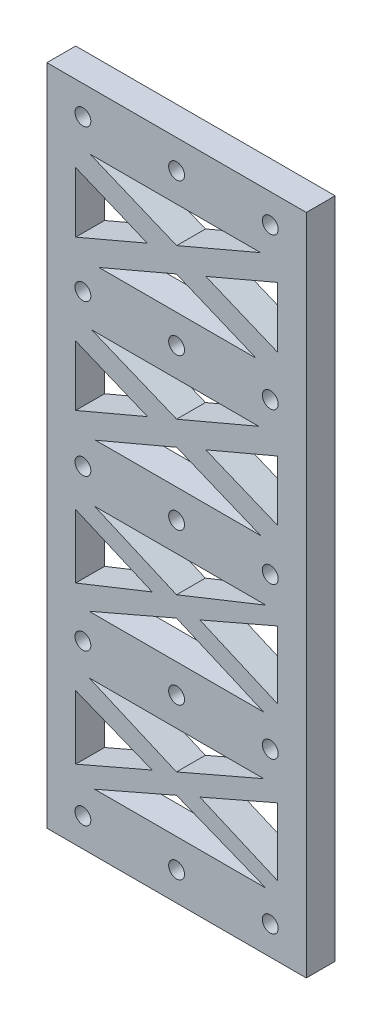
from build123d import *

# Parameters (mm, degrees)
SKETCH_1_W          = 72
SKETCH_1_H          = 100
EXTRUDE_1_DEPTH     = 8
CUT_EXTRUDE_1_REACH = 64.129
SKETCH_2_R          = 2.2
SKETCH_2_W          = 56
SKETCH_2_H          = 26
EXTRUDE_2_DEPTH     = 8
SKETCH_4_W          = 72
SKETCH_4_H          = 84
EXTRUDE_3_DEPTH     = 8
SKETCH_5_R          = 2.2
SKETCH_5_W          = 56
SKETCH_5_H          = 26
CUT_EXTRUDE_2_DEPTH = 8
EXTRUDE_4_DEPTH     = 8


with BuildPart() as part:
    # 草图1 → 凸台-拉伸1 (new body)
    with BuildSketch(Plane.XY):
        Rectangle(SKETCH_1_W, SKETCH_1_H)
    extrude(amount=EXTRUDE_1_DEPTH)

    # 草图2 → 切除-拉伸1 (cut, up to next)
    with BuildSketch(Plane.XY.offset(8), mode=Mode.PRIVATE) as cut_extrude_1_sk1:
        with Locations((-26, -42)):
            Circle(SKETCH_2_R)
    cut_extrude_1_tool1 = extrude(cut_extrude_1_sk1.sketch, amount=-CUT_EXTRUDE_1_REACH, mode=Mode.PRIVATE) & part.part
    # 草图2 → 切除-拉伸1 (cut, up to next)
    with BuildSketch(Plane.XY.offset(8), mode=Mode.PRIVATE) as cut_extrude_1_sk2:
        with Locations((0, -42)):
            Circle(SKETCH_2_R)
    cut_extrude_1_tool2 = extrude(cut_extrude_1_sk2.sketch, amount=-CUT_EXTRUDE_1_REACH, mode=Mode.PRIVATE) & part.part
    # 草图2 → 切除-拉伸1 (cut, up to next)
    with BuildSketch(Plane.XY.offset(8), mode=Mode.PRIVATE) as cut_extrude_1_sk3:
        with Locations((26, -42)):
            Circle(SKETCH_2_R)
    cut_extrude_1_tool3 = extrude(cut_extrude_1_sk3.sketch, amount=-CUT_EXTRUDE_1_REACH, mode=Mode.PRIVATE) & part.part
    # 草图2 → 切除-拉伸1 (cut, up to next)
    with BuildSketch(Plane.XY.offset(8), mode=Mode.PRIVATE) as cut_extrude_1_sk4:
        with Locations((26, 42)):
            Circle(SKETCH_2_R)
    cut_extrude_1_tool4 = extrude(cut_extrude_1_sk4.sketch, amount=-CUT_EXTRUDE_1_REACH, mode=Mode.PRIVATE) & part.part
    # 草图2 → 切除-拉伸1 (cut, up to next)
    with BuildSketch(Plane.XY.offset(8), mode=Mode.PRIVATE) as cut_extrude_1_sk5:
        with Locations((0, 42)):
            Circle(SKETCH_2_R)
    cut_extrude_1_tool5 = extrude(cut_extrude_1_sk5.sketch, amount=-CUT_EXTRUDE_1_REACH, mode=Mode.PRIVATE) & part.part
    # 草图2 → 切除-拉伸1 (cut, up to next)
    with BuildSketch(Plane.XY.offset(8), mode=Mode.PRIVATE) as cut_extrude_1_sk6:
        with Locations((-26, 42)):
            Circle(SKETCH_2_R)
    cut_extrude_1_tool6 = extrude(cut_extrude_1_sk6.sketch, amount=-CUT_EXTRUDE_1_REACH, mode=Mode.PRIVATE) & part.part
    # 草图2 → 切除-拉伸1 (cut, up to next)
    with BuildSketch(Plane.XY.offset(8), mode=Mode.PRIVATE) as cut_extrude_1_sk7:
        with Locations((-26, 0)):
            Circle(SKETCH_2_R)
    cut_extrude_1_tool7 = extrude(cut_extrude_1_sk7.sketch, amount=-CUT_EXTRUDE_1_REACH, mode=Mode.PRIVATE) & part.part
    # 草图2 → 切除-拉伸1 (cut, up to next)
    with BuildSketch(Plane.XY.offset(8), mode=Mode.PRIVATE) as cut_extrude_1_sk8:
        Circle(SKETCH_2_R)
    cut_extrude_1_tool8 = extrude(cut_extrude_1_sk8.sketch, amount=-CUT_EXTRUDE_1_REACH, mode=Mode.PRIVATE) & part.part
    # 草图2 → 切除-拉伸1 (cut, up to next)
    with BuildSketch(Plane.XY.offset(8), mode=Mode.PRIVATE) as cut_extrude_1_sk9:
        with Locations((26, 0)):
            Circle(SKETCH_2_R)
    cut_extrude_1_tool9 = extrude(cut_extrude_1_sk9.sketch, amount=-CUT_EXTRUDE_1_REACH, mode=Mode.PRIVATE) & part.part
    # 草图2 → 切除-拉伸1 (cut, up to next)
    with BuildSketch(Plane.XY.offset(8), mode=Mode.PRIVATE) as cut_extrude_1_sk10:
        with Locations((0, 21)):
            Rectangle(SKETCH_2_W, SKETCH_2_H)
    cut_extrude_1_tool10 = extrude(cut_extrude_1_sk10.sketch, amount=-CUT_EXTRUDE_1_REACH, mode=Mode.PRIVATE) & part.part
    # 草图2 → 切除-拉伸1 (cut, up to next)
    with BuildSketch(Plane.XY.offset(8), mode=Mode.PRIVATE) as cut_extrude_1_sk11:
        with Locations((0, -21)):
            Rectangle(SKETCH_2_W, SKETCH_2_H)
    cut_extrude_1_tool11 = extrude(cut_extrude_1_sk11.sketch, amount=-CUT_EXTRUDE_1_REACH, mode=Mode.PRIVATE) & part.part
    add(cut_extrude_1_tool1.solids().sort_by_distance((-26, -42, 8))[0], mode=Mode.SUBTRACT)
    add(cut_extrude_1_tool2.solids().sort_by_distance((0, -42, 8))[0], mode=Mode.SUBTRACT)
    add(cut_extrude_1_tool3.solids().sort_by_distance((26, -42, 8))[0], mode=Mode.SUBTRACT)
    add(cut_extrude_1_tool4.solids().sort_by_distance((26, 42, 8))[0], mode=Mode.SUBTRACT)
    add(cut_extrude_1_tool5.solids().sort_by_distance((0, 42, 8))[0], mode=Mode.SUBTRACT)
    add(cut_extrude_1_tool6.solids().sort_by_distance((-26, 42, 8))[0], mode=Mode.SUBTRACT)
    add(cut_extrude_1_tool7.solids().sort_by_distance((-26, 0, 8))[0], mode=Mode.SUBTRACT)
    add(cut_extrude_1_tool8.solids().sort_by_distance((0, 0, 8))[0], mode=Mode.SUBTRACT)
    add(cut_extrude_1_tool9.solids().sort_by_distance((26, 0, 8))[0], mode=Mode.SUBTRACT)
    add(cut_extrude_1_tool10.solids().sort_by_distance((0, 21, 8))[0], mode=Mode.SUBTRACT)
    add(cut_extrude_1_tool11.solids().sort_by_distance((0, -21, 8))[0], mode=Mode.SUBTRACT)

    # 草图3 → 凸台-拉伸2 (add)
    with BuildSketch(Plane.XY.offset(8)):
        Polygon((-28, 30.60122868), (-6.768682564, 21.407188314), (-28, 12.93157869), (-28, 8), (-24.288219299, 8), (-0.025829724, 18.487253581), (24.191837476, 8), (28, 8), (28, 11.903155093), (6.450556004, 21.286627452), (28, 30.60122868), (28, 34), (24.776184912, 34), (-0.016552798, 24.102660047), (-22.746110137, 34), (-28, 34), align=None)
        Polygon((-28, -8), (-24.288219299, -8), (-0.025829724, -18.487253581), (24.191837476, -8), (28, -8), (28, -11.903155093), (6.450556004, -21.286627452), (28, -30.60122868), (28, -34), (24.776184912, -34), (-0.016552798, -24.102660047), (-22.746110137, -34), (-28, -34), (-28, -30.60122868), (-6.768682564, -21.407188314), (-28, -12.93157869), align=None)
    extrude(amount=-EXTRUDE_2_DEPTH)

    # 草图4 → 凸台-拉伸3 (add)
    with BuildSketch(Plane.XY.offset(8)):
        with Locations((0, 92)):
            Rectangle(SKETCH_4_W, SKETCH_4_H)
    extrude(amount=-EXTRUDE_3_DEPTH)

    # 草图5 → 切除-拉伸2 (cut)
    with BuildSketch(Plane.XY.offset(8)):
        with Locations((0, 84)):
            Circle(SKETCH_5_R)
        with Locations((0, 126)):
            Circle(SKETCH_5_R)
        with Locations((26, 126)):
            Circle(SKETCH_5_R)
        with Locations((-26, 126)):
            Circle(SKETCH_5_R)
        with Locations((-26, 84)):
            Circle(SKETCH_5_R)
        with Locations((26, 84)):
            Circle(SKETCH_5_R)
        with Locations((0, 105)):
            Rectangle(SKETCH_5_W, SKETCH_5_H)
        with Locations((0, 63)):
            Rectangle(SKETCH_5_W, SKETCH_5_H)
    extrude(amount=-CUT_EXTRUDE_2_DEPTH, mode=Mode.SUBTRACT)

    # 草图6 → 凸台-拉伸4 (add)
    with BuildSketch(Plane.XY.offset(8)):
        Polygon((-23.974932243, 118), (0.019492881, 108.0358887), (23.327208426, 118), (28, 118), (28, 113.17961686), (8.109494179, 104.676371941), (28, 96.416486039), (28, 92), (22.06939562, 92), (-0.053196802, 101.186799516), (-21.542650648, 92), (-28, 92), (-28, 96.057479873), (-8.1431981, 104.546316276), (-28, 112.792206026), (-28, 118), align=None)
        Polygon((-23.547674388, 76), (0.012222409, 66.314841093), (22.812282036, 76), (28, 76), (28, 71.451887213), (8.089746155, 62.994278964), (28, 54.80943953), (28, 50), (23.327208426, 50), (0.037852996, 59.573942964), (-22.500390573, 50), (-28, 50), (-28, 54.415625486), (-8.03967075, 62.894505093), (-28, 71.099929858), (-28, 76), align=None)
    extrude(amount=-EXTRUDE_4_DEPTH)


solid = part.part
